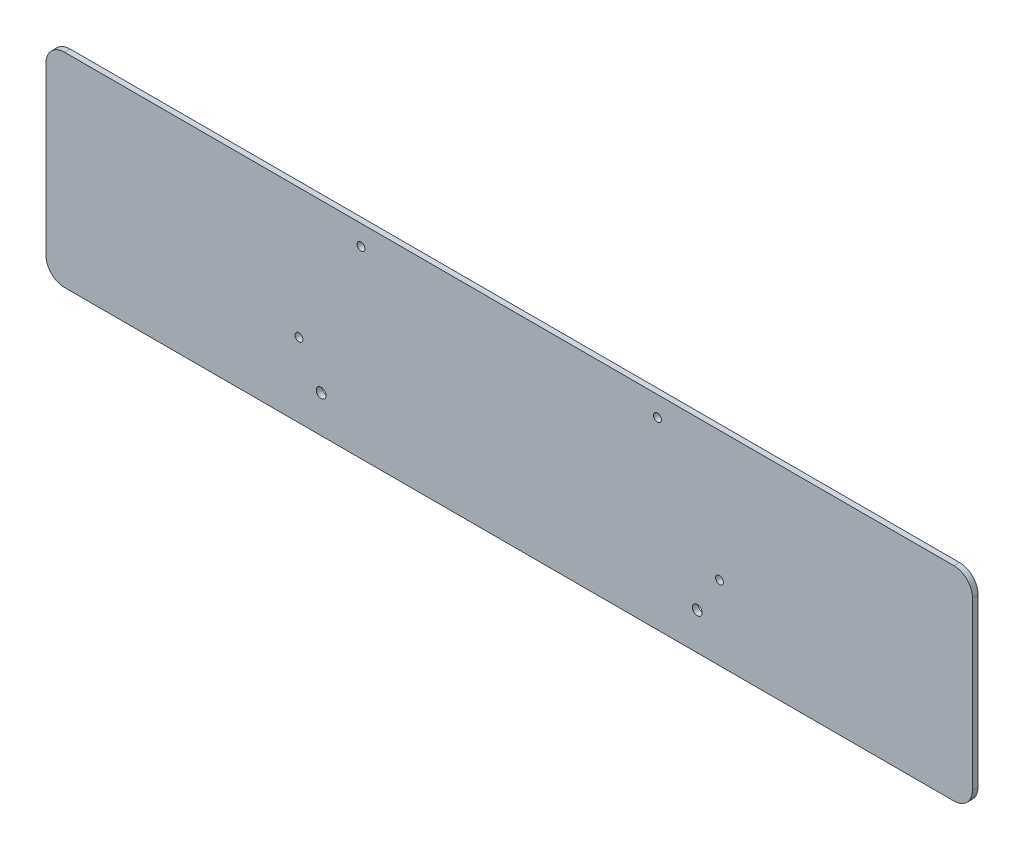
from build123d import *

# Parameters (mm, degrees)
SKETCH1_W           = 500
SKETCH1_H           = 110
BOSS_EXTRUDE1_DEPTH = 3
SKETCH2_R           = 2.65
SKETCH2_R_2         = 2.125
CUT_EXTRUDE1_DEPTH  = 10
SKETCH3_R           = 2.125
CUT_EXTRUDE2_DEPTH  = 10
FILLET1_R           = 10


with BuildPart() as part:
    # Sketch1 → Boss-Extrude1 (new body)
    with BuildSketch(Plane.XY):
        with Locations((250, 55)):
            Rectangle(SKETCH1_W, SKETCH1_H)
    extrude(amount=BOSS_EXTRUDE1_DEPTH)

    # Sketch2 → Cut-Extrude1 (cut)
    with BuildSketch(Plane.XY.offset(3)):
        with Locations((148.5, 20)):
            Circle(SKETCH2_R)
        with Locations((136.5, 40)):
            Circle(SKETCH2_R_2)
        with Locations(Location((363.5, 40, 0), (0, 0, 180))):
            Circle(SKETCH2_R_2)
        with Locations(Location((351.5, 20, 0), (0, 0, 180))):
            Circle(SKETCH2_R)
    extrude(amount=-CUT_EXTRUDE1_DEPTH, mode=Mode.SUBTRACT)

    # Sketch3 → Cut-Extrude2 (cut)
    with BuildSketch(Plane.XY.offset(3)):
        with Locations((170, 99.2)):
            Circle(SKETCH3_R)
        with Locations(Location((330, 99.2, 0), (0, 0, 180))):
            Circle(SKETCH3_R)
    extrude(amount=-CUT_EXTRUDE2_DEPTH, mode=Mode.SUBTRACT)

    # Fillet1
    fillet1_edges = [part.edges().sort_by_distance(p)[0] for p in [
        (0, 110, 1.5),
        (500, 110, 1.5),
        (500, 0, 1.5),
        (0, 0, 1.5),
    ]]
    fillet(fillet1_edges, radius=FILLET1_R)


solid = part.part
